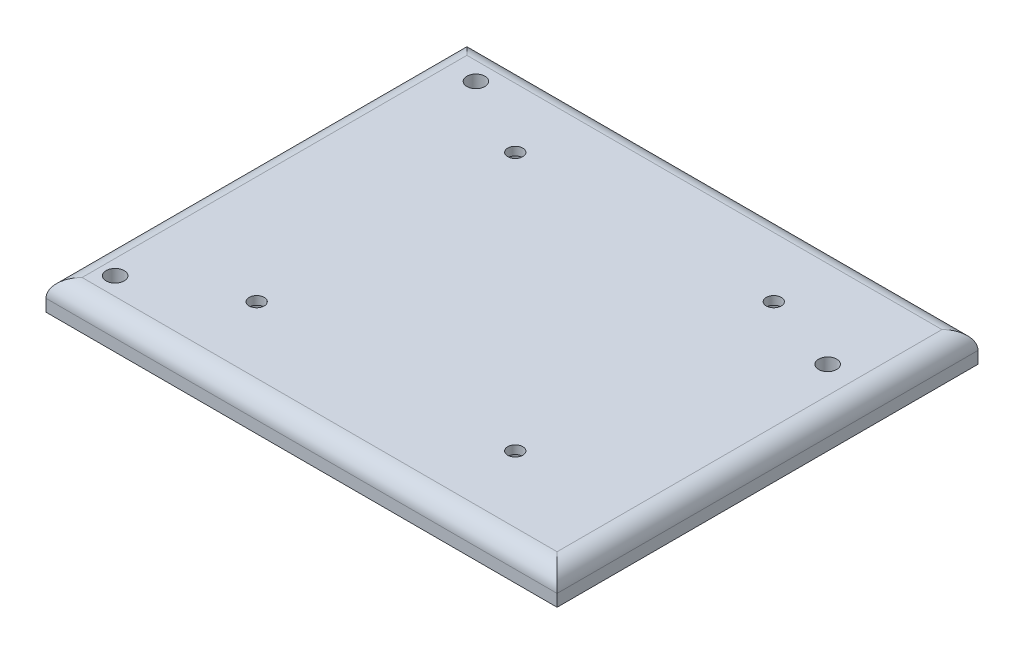
from build123d import *

# Parameters (mm, degrees)
SKETCH1_W           = 85
SKETCH1_H           = 70
SKETCH1_R           = 1.5
BOSS_EXTRUDE1_DEPTH = 5
CUT_EXTRUDE1_REACH  = 57.283
SKETCH3_R           = 1.25
SKETCH4_R           = 3
CUT_EXTRUDE2_DEPTH  = 3.6
FILLET2_R           = 3


with BuildPart() as part:
    # Sketch1 → Boss-Extrude1 (new body)
    with BuildSketch(Plane(origin=(0, 0, 0), x_dir=(1, 0, 0), z_dir=(0, 1, 0))):
        Rectangle(SKETCH1_W, SKETCH1_H)
        with Locations(Location((-35, 29, 0), (0, 0, 270))):
            Circle(SKETCH1_R, mode=Mode.SUBTRACT)
        with Locations(Location((-37, -29, 0), (0, 0, 270))):
            Circle(SKETCH1_R, mode=Mode.SUBTRACT)
        with Locations(Location((35, 17.5, 0), (0, 0, 270))):
            Circle(SKETCH1_R, mode=Mode.SUBTRACT)
    extrude(amount=BOSS_EXTRUDE1_DEPTH)

    # Sketch3 → Cut-Extrude1 (cut, up to next)
    with BuildSketch(Plane(origin=(0, 5, 0), x_dir=(1, 0, 0), z_dir=(0, 1, 0)), mode=Mode.PRIVATE) as cut_extrude1_sk1:
        with Locations(Location((-21.5, 22.037196785, 0), (0, 0, 270))):
            Circle(SKETCH3_R)
    cut_extrude1_tool1 = extrude(cut_extrude1_sk1.sketch, amount=-CUT_EXTRUDE1_REACH, mode=Mode.PRIVATE) & part.part
    # Sketch3 → Cut-Extrude1 (cut, up to next)
    with BuildSketch(Plane(origin=(0, 5, 0), x_dir=(1, 0, 0), z_dir=(0, 1, 0)), mode=Mode.PRIVATE) as cut_extrude1_sk2:
        with Locations(Location((21.5, 22.037196785, 0), (0, 0, 270))):
            Circle(SKETCH3_R)
    cut_extrude1_tool2 = extrude(cut_extrude1_sk2.sketch, amount=-CUT_EXTRUDE1_REACH, mode=Mode.PRIVATE) & part.part
    # Sketch3 → Cut-Extrude1 (cut, up to next)
    with BuildSketch(Plane(origin=(0, 5, 0), x_dir=(1, 0, 0), z_dir=(0, 1, 0)), mode=Mode.PRIVATE) as cut_extrude1_sk3:
        with Locations(Location((-21.5, -20.962803215, 0), (0, 0, 270))):
            Circle(SKETCH3_R)
    cut_extrude1_tool3 = extrude(cut_extrude1_sk3.sketch, amount=-CUT_EXTRUDE1_REACH, mode=Mode.PRIVATE) & part.part
    # Sketch3 → Cut-Extrude1 (cut, up to next)
    with BuildSketch(Plane(origin=(0, 5, 0), x_dir=(1, 0, 0), z_dir=(0, 1, 0)), mode=Mode.PRIVATE) as cut_extrude1_sk4:
        with Locations(Location((21.5, -20.962803215, 0), (0, 0, 270))):
            Circle(SKETCH3_R)
    cut_extrude1_tool4 = extrude(cut_extrude1_sk4.sketch, amount=-CUT_EXTRUDE1_REACH, mode=Mode.PRIVATE) & part.part
    add(cut_extrude1_tool1.solids().sort_by_distance((-21.5, 5, -22.037197))[0], mode=Mode.SUBTRACT)
    add(cut_extrude1_tool2.solids().sort_by_distance((21.5, 5, -22.037197))[0], mode=Mode.SUBTRACT)
    add(cut_extrude1_tool3.solids().sort_by_distance((-21.5, 5, 20.962803))[0], mode=Mode.SUBTRACT)
    add(cut_extrude1_tool4.solids().sort_by_distance((21.5, 5, 20.962803))[0], mode=Mode.SUBTRACT)

    # Sketch4 → Cut-Extrude2 (cut)
    with BuildSketch(Plane.XZ):
        with Locations(Location((-21.5, 20.962803215, 0), (0, 0, 270))):
            Circle(SKETCH4_R)
        with Locations(Location((21.5, 20.962803215, 0), (0, 0, 270))):
            Circle(SKETCH4_R)
        with Locations(Location((21.5, -22.037196785, 0), (0, 0, 270))):
            Circle(SKETCH4_R)
        with Locations(Location((-21.5, -22.037196785, 0), (0, 0, 270))):
            Circle(SKETCH4_R)
    extrude(amount=-CUT_EXTRUDE2_DEPTH, mode=Mode.SUBTRACT)

    # Fillet2
    fillet2_edges = [part.edges().sort_by_distance(p)[0] for p in [
        (42.5, 5, 0),
        (0, 5, -35),
        (-42.5, 5, 0),
        (0, 5, 35),
    ]]
    fillet(fillet2_edges, radius=FILLET2_R)


solid = part.part
